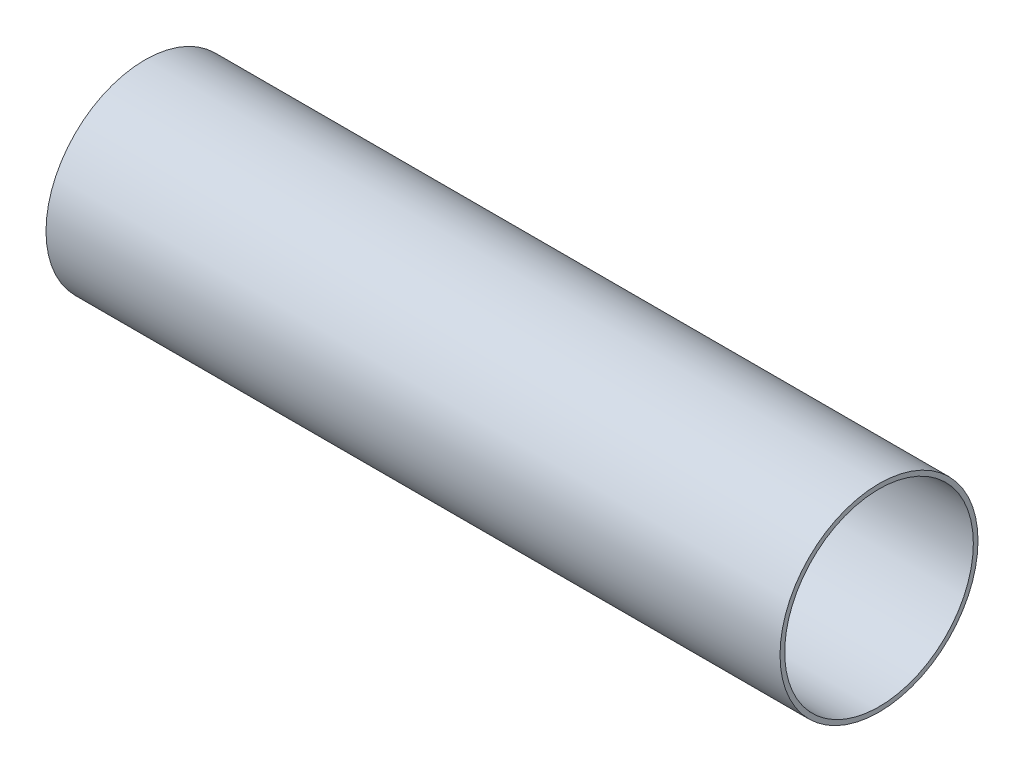
from build123d import *

# Parameters (mm, degrees)
SKETCH1_R           = 16.79
SKETCH1_R_2         = 16
BOSS_EXTRUDE1_DEPTH = 124.5


with BuildPart() as part:
    # Sketch1 → Boss-Extrude1 (new body)
    with BuildSketch(Plane(origin=(0, 0, 0), x_dir=(0, 0, -1), z_dir=(1, 0, 0))):
        Circle(SKETCH1_R)
        Circle(SKETCH1_R_2, mode=Mode.SUBTRACT)
    extrude(amount=BOSS_EXTRUDE1_DEPTH)


solid = part.part
